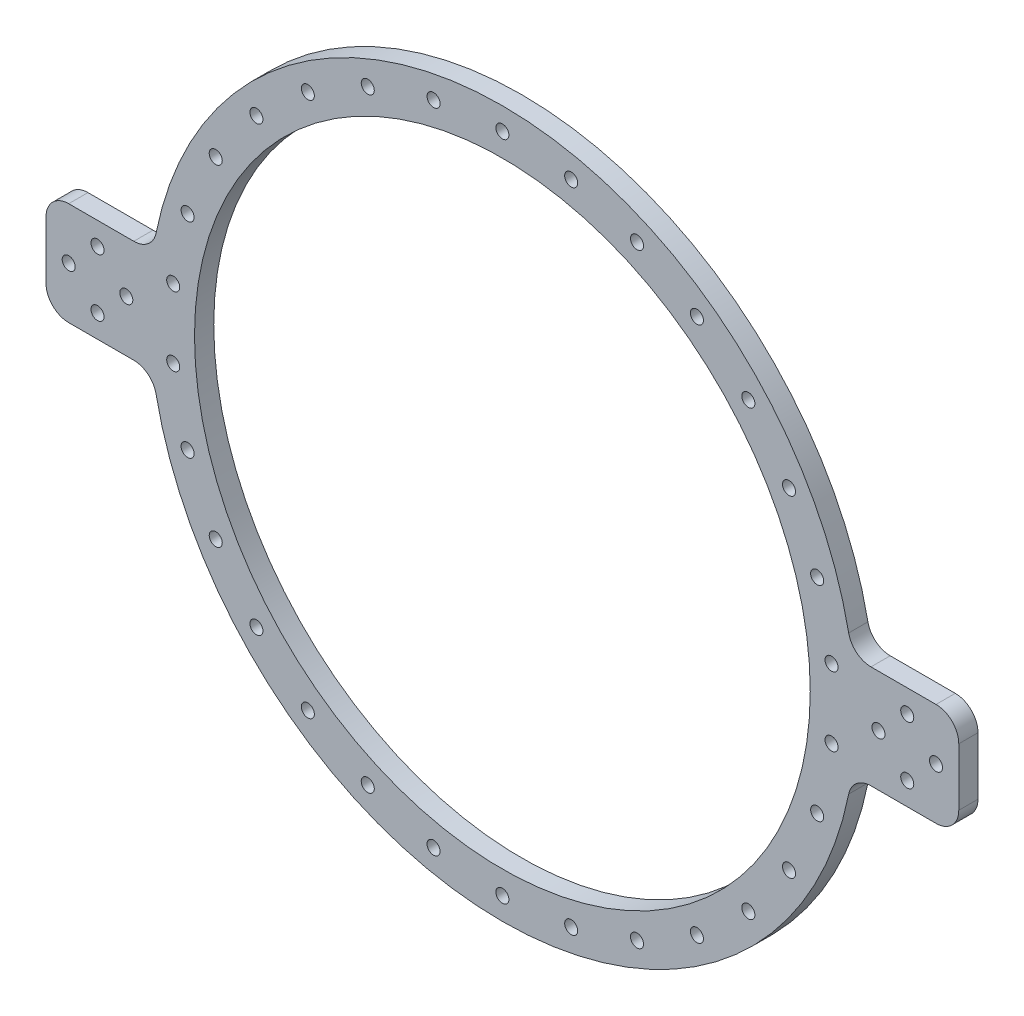
from build123d import *

# Parameters (mm, degrees)
SKETCH1_R           = 101.6
SKETCH1_R_2         = 2.1525
SKETCH1_R_3         = 2.1524976
BOSS_EXTRUDE1_DEPTH = 6.35
FILLET1_R           = 7.5


with BuildPart() as part:
    # Sketch1 → Boss-Extrude1 (new body)
    with BuildSketch(Plane.XY):
        with BuildLine():
            Line((115.326459663, 17), (143.1000104, 17))
            ThreePointArc((143.1000104, 17), (148.403311259, 14.803300859), (150.6000104, 9.5))
            Line((150.6000104, 9.5), (150.6000104, -9.5))
            ThreePointArc((150.6000104, -9.5), (148.403311259, -14.803300859), (143.1000104, -17))
            Line((143.1000104, -17), (115.326459663, -17))
            ThreePointArc((115.326459663, -17), (0, -116.572691049), (-115.326459663, -17))
            Line((-115.326459663, -17), (-143.1000104, -17))
            ThreePointArc((-143.1000104, -17), (-148.403311259, -14.803300859), (-150.6000104, -9.5))
            Line((-150.6000104, -9.5), (-150.6000104, 9.5))
            ThreePointArc((-150.6000104, 9.5), (-148.403311259, 14.803300859), (-143.1000104, 17))
            Line((-143.1000104, 17), (-115.326459663, 17))
            ThreePointArc((-115.326459663, 17), (0, 116.572691049), (115.326459663, 17))
        make_face()
        Circle(SKETCH1_R, mode=Mode.SUBTRACT)
        with Locations((133.6000104, 9.5)):
            Circle(SKETCH1_R_2, mode=Mode.SUBTRACT)
        with Locations((133.6000104, -9.5)):
            Circle(SKETCH1_R_2, mode=Mode.SUBTRACT)
        with Locations((143.1000104, 0)):
            Circle(SKETCH1_R_2, mode=Mode.SUBTRACT)
        with Locations((124.1000104, 0)):
            Circle(SKETCH1_R_2, mode=Mode.SUBTRACT)
        with Locations(Location((-143.1000104, 0, 0), (0, 0, 180))):
            Circle(SKETCH1_R_2, mode=Mode.SUBTRACT)
        with Locations(Location((-133.6000104, -9.5, 0), (0, 0, 180))):
            Circle(SKETCH1_R_2, mode=Mode.SUBTRACT)
        with Locations(Location((-124.1000104, 0, 0), (0, 0, 180))):
            Circle(SKETCH1_R_2, mode=Mode.SUBTRACT)
        with Locations(Location((-133.6000104, 9.5, 0), (0, 0, 180))):
            Circle(SKETCH1_R_2, mode=Mode.SUBTRACT)
        with Locations((0, 109.22)):
            Circle(SKETCH1_R_3, mode=Mode.SUBTRACT)
        with Locations((22.708114871, 106.833280952)):
            Circle(SKETCH1_R_3, mode=Mode.SUBTRACT)
        with Locations((44.423776157, 99.777434884)):
            Circle(SKETCH1_R_3, mode=Mode.SUBTRACT)
        with Locations((64.197905255, 88.360836126)):
            Circle(SKETCH1_R_3, mode=Mode.SUBTRACT)
        with Locations((81.166277839, 73.082444827)):
            Circle(SKETCH1_R_3, mode=Mode.SUBTRACT)
        with Locations((94.587294601, 54.61)):
            Circle(SKETCH1_R_3, mode=Mode.SUBTRACT)
        with Locations((103.87439271, 33.750836126)):
            Circle(SKETCH1_R_3, mode=Mode.SUBTRACT)
        with Locations((108.621681412, 11.416598758)):
            Circle(SKETCH1_R_3, mode=Mode.SUBTRACT)
        with Locations((108.621681412, -11.416598758)):
            Circle(SKETCH1_R_3, mode=Mode.SUBTRACT)
        with Locations((103.87439271, -33.750836126)):
            Circle(SKETCH1_R_3, mode=Mode.SUBTRACT)
        with Locations((94.587294601, -54.61)):
            Circle(SKETCH1_R_3, mode=Mode.SUBTRACT)
        with Locations((81.166277839, -73.082444827)):
            Circle(SKETCH1_R_3, mode=Mode.SUBTRACT)
        with Locations((64.197905255, -88.360836126)):
            Circle(SKETCH1_R_3, mode=Mode.SUBTRACT)
        with Locations((44.423776157, -99.777434884)):
            Circle(SKETCH1_R_3, mode=Mode.SUBTRACT)
        with Locations((22.708114871, -106.833280952)):
            Circle(SKETCH1_R_3, mode=Mode.SUBTRACT)
        with Locations((0, -109.22)):
            Circle(SKETCH1_R_3, mode=Mode.SUBTRACT)
        with Locations((-22.708114871, -106.833280952)):
            Circle(SKETCH1_R_3, mode=Mode.SUBTRACT)
        with Locations((-44.423776157, -99.777434884)):
            Circle(SKETCH1_R_3, mode=Mode.SUBTRACT)
        with Locations((-64.197905255, -88.360836126)):
            Circle(SKETCH1_R_3, mode=Mode.SUBTRACT)
        with Locations((-81.166277839, -73.082444827)):
            Circle(SKETCH1_R_3, mode=Mode.SUBTRACT)
        with Locations((-94.587294601, -54.61)):
            Circle(SKETCH1_R_3, mode=Mode.SUBTRACT)
        with Locations((-103.87439271, -33.750836126)):
            Circle(SKETCH1_R_3, mode=Mode.SUBTRACT)
        with Locations((-108.621681412, -11.416598758)):
            Circle(SKETCH1_R_3, mode=Mode.SUBTRACT)
        with Locations((-108.621681412, 11.416598758)):
            Circle(SKETCH1_R_3, mode=Mode.SUBTRACT)
        with Locations((-103.87439271, 33.750836126)):
            Circle(SKETCH1_R_3, mode=Mode.SUBTRACT)
        with Locations((-94.587294601, 54.61)):
            Circle(SKETCH1_R_3, mode=Mode.SUBTRACT)
        with Locations((-81.166277839, 73.082444827)):
            Circle(SKETCH1_R_3, mode=Mode.SUBTRACT)
        with Locations((-64.197905255, 88.360836126)):
            Circle(SKETCH1_R_3, mode=Mode.SUBTRACT)
        with Locations((-44.423776157, 99.777434884)):
            Circle(SKETCH1_R_3, mode=Mode.SUBTRACT)
        with Locations((-22.708114871, 106.833280952)):
            Circle(SKETCH1_R_3, mode=Mode.SUBTRACT)
    extrude(amount=BOSS_EXTRUDE1_DEPTH)

    # Fillet1
    fillet1_edges = [part.edges().sort_by_distance(p)[0] for p in [
        (115.326459663, 17, 3.175),
        (115.326459663, -17, 3.175),
        (-115.326459663, -17, 3.175),
        (-115.326459663, 17, 3.175),
    ]]
    fillet(fillet1_edges, radius=FILLET1_R)


solid = part.part
